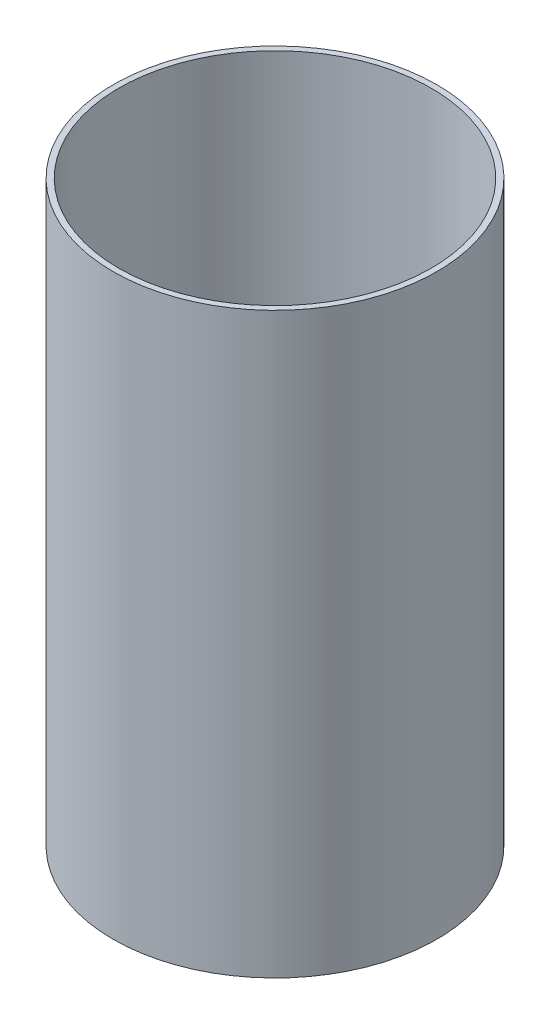
from build123d import *

# Parameters (mm, degrees)
SKETCH1_R           = 14
SKETCH1_R_2         = 13.5
BOSS_EXTRUDE1_DEPTH = 50


with BuildPart() as part:
    # Sketch1 → Boss-Extrude1 (new body)
    with BuildSketch(Plane(origin=(0, 0, 0), x_dir=(1, 0, 0), z_dir=(0, 1, 0))):
        with Locations(Location((0, 0, 0), (0, 0, 270))):
            Circle(SKETCH1_R)
        with Locations(Location((0, 0, 0), (0, 0, 270))):
            Circle(SKETCH1_R_2, mode=Mode.SUBTRACT)
    extrude(amount=BOSS_EXTRUDE1_DEPTH)


solid = part.part
